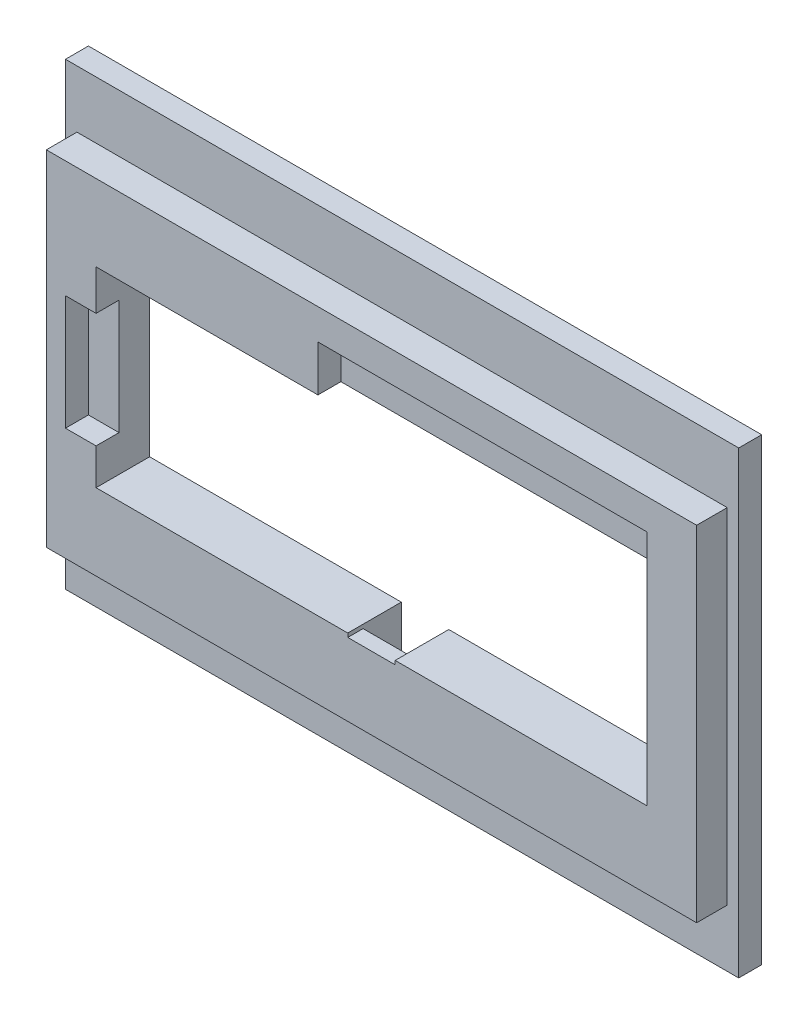
from build123d import *

# Parameters (mm, degrees)
SKETCH5_W           = 85
SKETCH5_H           = 45
SKETCH5_W_2         = 72
SKETCH5_H_2         = 25
BOSS_EXTRUDE3_DEPTH = 4
SKETCH10_W          = 88
SKETCH10_H          = 60
SKETCH10_W_2        = 72
SKETCH10_H_2        = 25
BOSS_EXTRUDE4_DEPTH = 3
SKETCH12_W          = 4
SKETCH12_H          = 15
CUT_EXTRUDE6_DEPTH  = 3
SKETCH13_W          = 43
SKETCH13_H          = 6
CUT_EXTRUDE7_DEPTH  = 3
SKETCH18_W          = 6.2
SKETCH18_H          = 5
CUT_EXTRUDE10_DEPTH = 9
SKETCH19_W          = 6.2
SKETCH19_H          = 0.5
CUT_EXTRUDE11_DEPTH = 10


with BuildPart() as part:
    # Sketch5 → Boss-Extrude3 (new body)
    with BuildSketch(Plane.XY):
        Rectangle(SKETCH5_W, SKETCH5_H)
        Rectangle(SKETCH5_W_2, SKETCH5_H_2, mode=Mode.SUBTRACT)
    extrude(amount=BOSS_EXTRUDE3_DEPTH)

    # Sketch10 → Boss-Extrude4 (add)
    with BuildSketch(Plane(origin=(0, 0, 0), x_dir=(-1, 0, 0), z_dir=(0, 0, -1))):
        Rectangle(SKETCH10_W, SKETCH10_H)
        Rectangle(SKETCH10_W_2, SKETCH10_H_2, mode=Mode.SUBTRACT)
    extrude(amount=BOSS_EXTRUDE4_DEPTH)

    # Sketch12 → Cut-Extrude6 (cut)
    with BuildSketch(Plane.XY.offset(4)):
        with Locations((-38, -0.264516135)):
            Rectangle(SKETCH12_W, SKETCH12_H)
    extrude(amount=-CUT_EXTRUDE6_DEPTH, mode=Mode.SUBTRACT)

    # Sketch13 → Cut-Extrude7 (cut)
    with BuildSketch(Plane.XY.offset(4)):
        with Locations((14.5, 15.5)):
            Rectangle(SKETCH13_W, SKETCH13_H)
    extrude(amount=-CUT_EXTRUDE7_DEPTH, mode=Mode.SUBTRACT)

    # Sketch18 → Cut-Extrude10 (cut)
    with BuildSketch(Plane(origin=(0, -12.5, 0), x_dir=(1, 0, 0), z_dir=(0, 1, 0))):
        with Locations((0, 0.5)):
            Rectangle(SKETCH18_W, SKETCH18_H)
    extrude(amount=-CUT_EXTRUDE10_DEPTH, mode=Mode.SUBTRACT)

    # Sketch19 → Cut-Extrude11 (cut)
    with BuildSketch(Plane(origin=(0, 0, 2), x_dir=(-1, 0, 0), z_dir=(0, 0, -1))):
        with Locations((0, -12.75)):
            Rectangle(SKETCH19_W, SKETCH19_H)
    extrude(amount=-CUT_EXTRUDE11_DEPTH, mode=Mode.SUBTRACT)


solid = part.part
